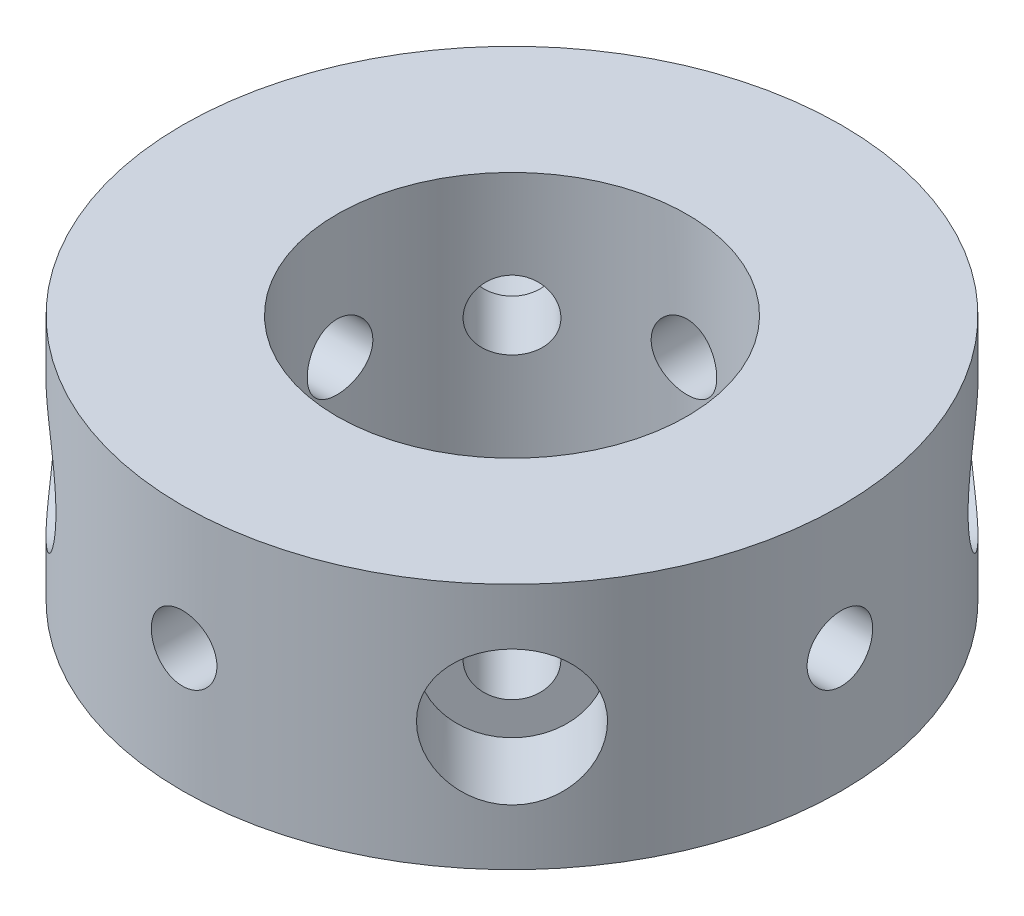
from build123d import *

# Parameters (mm, degrees)
SKETCH1_R                       = 25.4
SKETCH1_R_2                     = 13.49375
BOSS_EXTRUDE1_DEPTH             = 19.05
F_8_0_199_DIAMETER_HOLE1_REACH  = 61.906
F_8_0_199_DIAMETER_HOLE1_BORE_R = 2.5273
BULKHEAD_THROUGH_REACH          = 66.212
BULKHEAD_THROUGH_END_RADIUS     = 13.49375
SKETCH6_R                       = 2.667
SKETCH6_4_R                     = 5.207
ACCESS_HOLE_DEPTH               = 6.35
CIRPATTERN1_COUNT               = 4


with BuildPart() as part:
    # Sketch1 → Boss-Extrude1 (new body)
    with BuildSketch(Plane(origin=(0, 0, 0), x_dir=(1, 0, 0), z_dir=(0, 1, 0))):
        with Locations(Location((0, 0, 0), (0, 0, 90))):
            Circle(SKETCH1_R)
        with Locations(Location((0, 0, 0), (0, 0, 90))):
            Circle(SKETCH1_R_2, mode=Mode.SUBTRACT)
    extrude(amount=BOSS_EXTRUDE1_DEPTH)

    # #8 (0.199) Diameter Hole1 bore → #8 (0.199) Diameter Hole1 (cut, up to next)
    with BuildSketch(Plane(origin=(25.4, 0, 0), x_dir=(0, 0, -1), z_dir=(1, 0, 0)), mode=Mode.PRIVATE) as f_8_0_199_diameter_hole1_sk1:
        with Locations((0, 9.525)):
            Circle(F_8_0_199_DIAMETER_HOLE1_BORE_R)
    f_8_0_199_diameter_hole1_tool1 = extrude(f_8_0_199_diameter_hole1_sk1.sketch, amount=-F_8_0_199_DIAMETER_HOLE1_REACH, mode=Mode.PRIVATE) & part.part
    f_8_0_199_diameter_hole1 = f_8_0_199_diameter_hole1_tool1.solids().sort_by_distance((25.4, 9.525, 0))[0]
    add(f_8_0_199_diameter_hole1, mode=Mode.SUBTRACT)

    # bulkhead_through: up to this cylinder (the profile starts outside it)
    bulkhead_through_end = Plane(origin=(0, 9.525, 0), z_dir=(0, -1, 0)) * Cylinder(BULKHEAD_THROUGH_END_RADIUS, 160.4115, mode=Mode.PRIVATE)
    # Sketch6 → bulkhead_through (cut, up to the surface)
    with BuildSketch(Plane(origin=(17.960512242, 0, 17.960512242), x_dir=(0.7071067811865487, 0, -0.7071067811865465), z_dir=(0.7071067811865465, 0, 0.7071067811865487)), mode=Mode.PRIVATE) as bulkhead_through_sk1:
        with Locations((0, 9.525)):
            Circle(SKETCH6_R)
    bulkhead_through_tool1 = extrude(bulkhead_through_sk1.sketch, amount=-BULKHEAD_THROUGH_REACH, mode=Mode.PRIVATE) - bulkhead_through_end
    bulkhead_through = bulkhead_through_tool1.solids().sort_by_distance((17.960512, 9.525, 17.960512))[0]
    add(bulkhead_through, mode=Mode.SUBTRACT)

    # Sketch6<4> → access_hole (cut)
    with BuildSketch(Plane(origin=(17.960512242, 0, 17.960512242), x_dir=(0.7071067811865487, 0, -0.7071067811865465), z_dir=(0.7071067811865465, 0, 0.7071067811865487))):
        with Locations((0, 9.525)):
            Circle(SKETCH6_4_R)
    access_hole = extrude(amount=-ACCESS_HOLE_DEPTH, mode=Mode.SUBTRACT)

    # CirPattern1: #8 (0.199) Diameter Hole1, bulkhead_through, access_hole ×4 about axis
    cirpattern1_axis = Axis((0, 0, 0), (0, 1, 0))
    add([f_8_0_199_diameter_hole1.rotate(cirpattern1_axis, i * 360 / CIRPATTERN1_COUNT) for i in range(1, CIRPATTERN1_COUNT)], mode=Mode.SUBTRACT)
    add([bulkhead_through.rotate(cirpattern1_axis, i * 360 / CIRPATTERN1_COUNT) for i in range(1, CIRPATTERN1_COUNT)], mode=Mode.SUBTRACT)
    add([access_hole.rotate(cirpattern1_axis, i * 360 / CIRPATTERN1_COUNT) for i in range(1, CIRPATTERN1_COUNT)], mode=Mode.SUBTRACT)


solid = part.part
